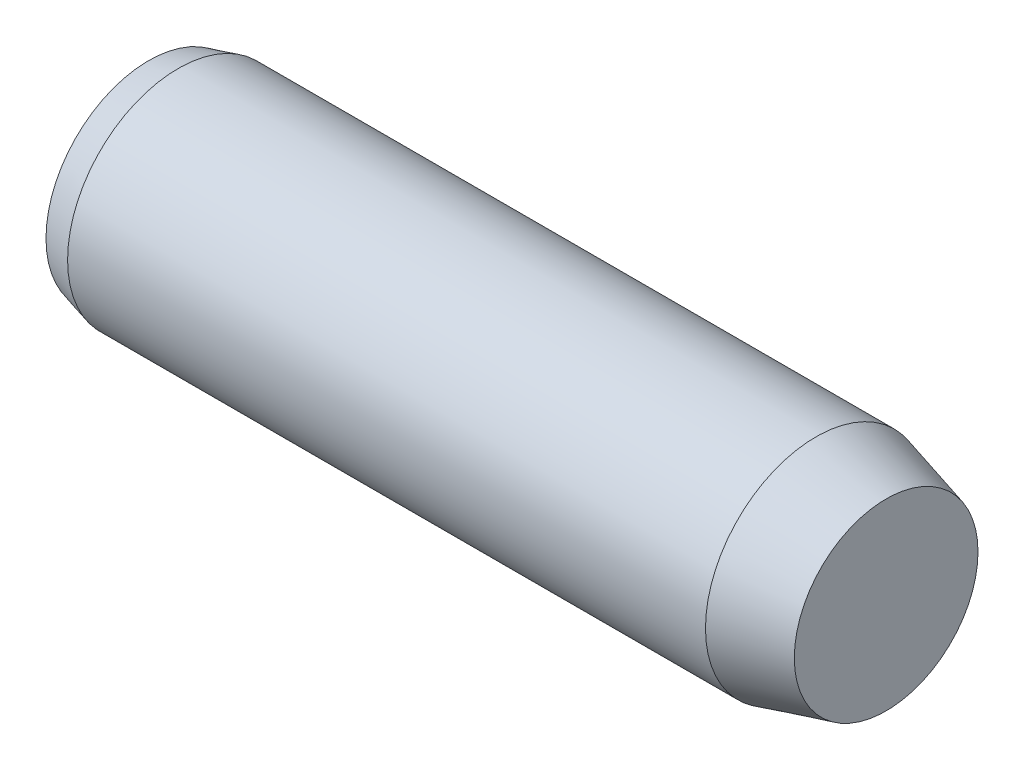
from build123d import *

# Parameters (mm, degrees)
M6_GEWINDEBOHRUNG1_D           = 5
M6_GEWINDEBOHRUNG1_DEPTH       = 15
M6_GEWINDEBOHRUNG1_CSINK_D     = 6.05
M6_GEWINDEBOHRUNG1_CSINK_ANGLE = 90
M6_GEWINDEBOHRUNG1_TIP         = 1.502151548


with BuildPart() as part:
    # Skizze1 → Rotation3 (revolve)
    with BuildSketch(Plane.XY, mode=Mode.PRIVATE) as rotation3_sk:
        Polygon((0, 0), (0, 5.571281292), (1.6, 6), (36.2, 6), (40, 4.981793069), (40, 0), align=None)
    revolve(rotation3_sk.sketch.rotate(Axis((0, 0, 0), (1, 0, 0)), 90), axis=Axis((0, 0, 0), (1, 0, 0)))

    # M6 Gewindebohrung1
    with Locations(Plane.ZY):
        with Locations((0, 0)):
            CounterSinkHole(M6_GEWINDEBOHRUNG1_D / 2, M6_GEWINDEBOHRUNG1_CSINK_D / 2, depth=M6_GEWINDEBOHRUNG1_DEPTH, counter_sink_angle=M6_GEWINDEBOHRUNG1_CSINK_ANGLE)
            with Locations((0, 0, -(M6_GEWINDEBOHRUNG1_DEPTH + M6_GEWINDEBOHRUNG1_TIP / 2))):  # 118° drill point
                Cone(0, M6_GEWINDEBOHRUNG1_D / 2, M6_GEWINDEBOHRUNG1_TIP, mode=Mode.SUBTRACT)


solid = part.part
